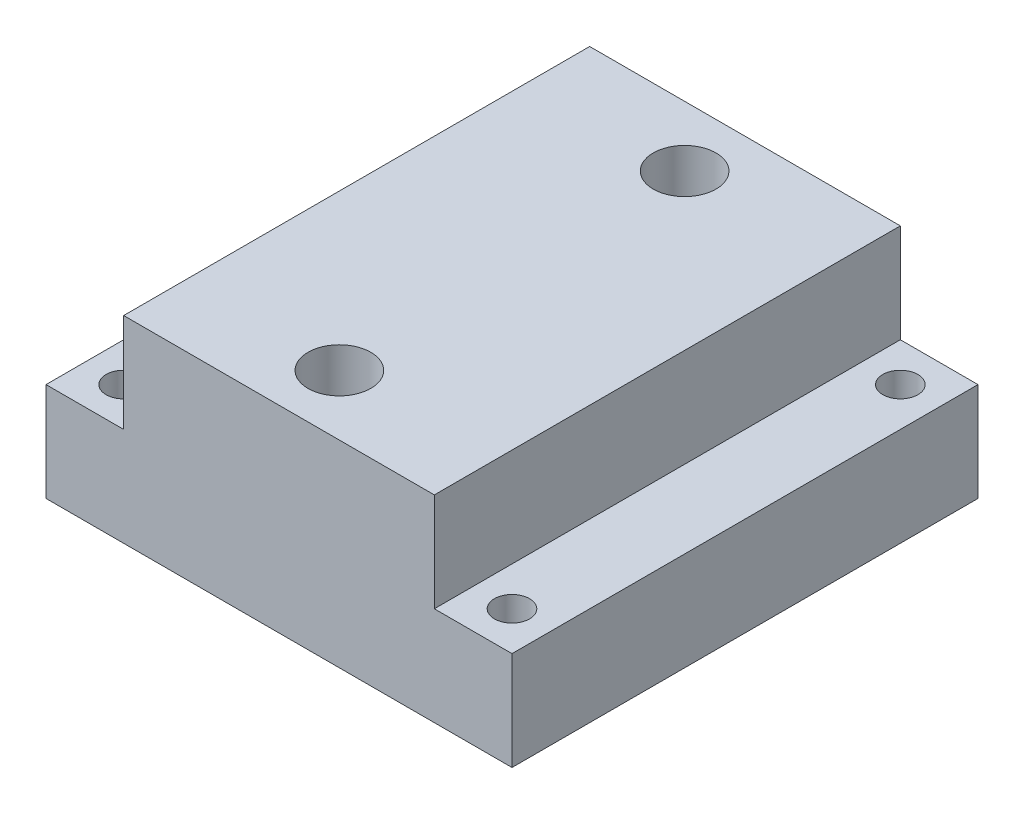
from build123d import *

# Parameters (mm, degrees)
SKETCH1_W              = 30
SKETCH1_H              = 12.7
BOSS_EXTRUDE1_DEPTH    = 30
F_2_CLEARANCE_HOLE1_D  = 2.2606
SKETCH4_OUTSIDE_W      = 40.858
SKETCH4_OUTSIDE_H      = 40.858
SKETCH4_OUTSIDE_W_2    = 20
SKETCH4_OUTSIDE_H_2    = 30
CUT_EXTRUDE1_DEPTH     = 6.35
F_10_32_TAPPED_HOLE1_D = 4.0386


with BuildPart() as part:
    # Sketch1 → Boss-Extrude1 (new body)
    with BuildSketch(Plane.XY):
        with Locations((15, 6.35)):
            Rectangle(SKETCH1_W, SKETCH1_H)
    extrude(amount=BOSS_EXTRUDE1_DEPTH)

    # #2 Clearance Hole1 (through all)
    with Locations(Plane(origin=(0, 12.7, 0), x_dir=(1, 0, 0), z_dir=(0, 1, 0))):
        with Locations((2.5, -2.5), (27.5, -2.5), (27.5, -27.5), (2.5, -27.5)):
            Hole(F_2_CLEARANCE_HOLE1_D / 2)

    # Sketch4 outside → Cut-Extrude1 (cut)
    with BuildSketch(Plane(origin=(0, 12.7, 0), x_dir=(1, 0, 0), z_dir=(0, 1, 0))):
        with Locations((15, -15)):
            Rectangle(SKETCH4_OUTSIDE_W, SKETCH4_OUTSIDE_H)
        with Locations((15, -15)):
            Rectangle(SKETCH4_OUTSIDE_W_2, SKETCH4_OUTSIDE_H_2, mode=Mode.SUBTRACT)
    extrude(amount=-CUT_EXTRUDE1_DEPTH, mode=Mode.SUBTRACT)

    # #10-32 Tapped Hole1 (through all)
    with Locations(Plane(origin=(0, 12.7, 0), x_dir=(1, 0, 0), z_dir=(0, 1, 0))):
        with Locations((15, -3.8875), (15, -26.1125)):
            Hole(F_10_32_TAPPED_HOLE1_D / 2)


solid = part.part
